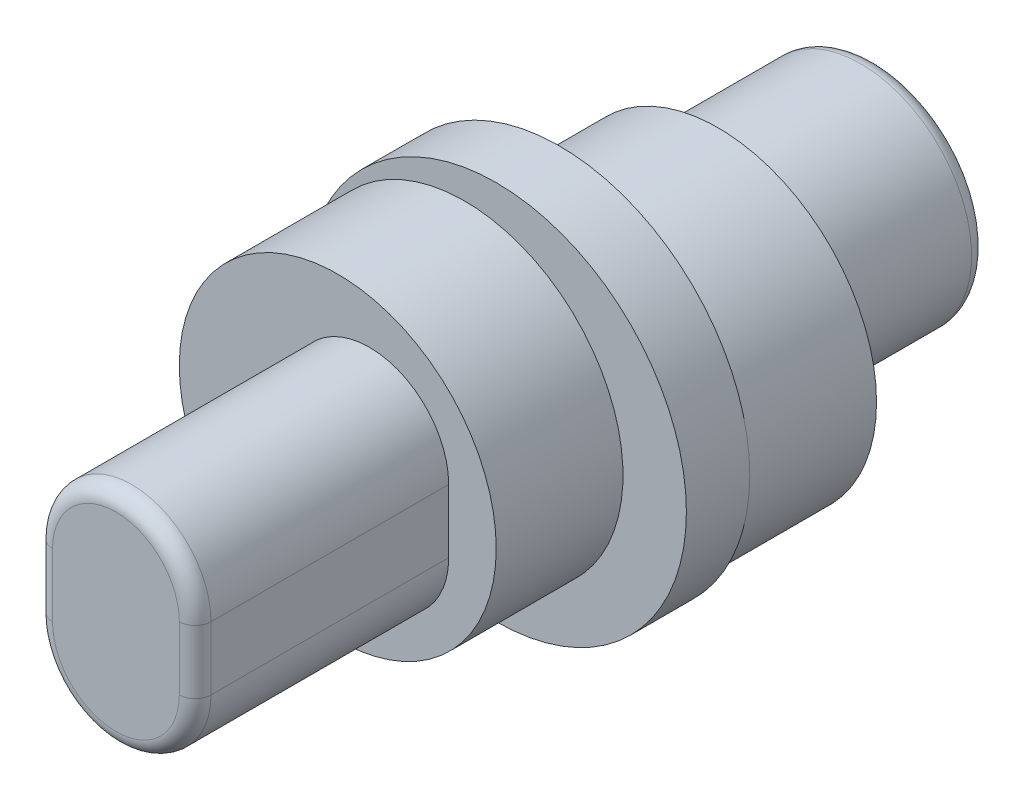
from build123d import *

# Parameters (mm, degrees)
SKETCH_1_R          = 5
EXTRUDE_1_DEPTH     = 4
SKETCH_2_R          = 6
EXTRUDE_2_DEPTH     = 2
SKETCH_3_R          = 5
EXTRUDE_3_DEPTH     = 4
SKETCH_4_R          = 3.5
EXTRUDE_4_DEPTH     = 8
EXTRUDE_START       = 6
SKETCH_5_R          = 3.5
EXTRUDE_5_DEPTH     = 6
CUT_EXTRUDE_START   = -8
CUT_EXTRUDE_2_DEPTH = 8
FILLET_1_R          = 0.5


with BuildPart() as part:
    # 草图1 → 凸台-拉伸1 (new body)
    with BuildSketch(Plane.XY):
        with Locations((-1, 0)):
            Circle(SKETCH_1_R)
    extrude(amount=EXTRUDE_1_DEPTH)

    # 草图2 → 凸台-拉伸2 (add)
    with BuildSketch(Plane(origin=(0, 0, 0), x_dir=(-1, 0, 0), z_dir=(0, 0, -1))):
        Circle(SKETCH_2_R)
    extrude(amount=EXTRUDE_2_DEPTH)

    # 草图3 → 凸台-拉伸3 (add)
    with BuildSketch(Plane(origin=(0, 0, -2), x_dir=(-1, 0, 0), z_dir=(0, 0, -1))):
        with Locations(Location((-1, 0, 0), (0, 0, 179.999112378))):
            Circle(SKETCH_3_R)
    extrude(amount=EXTRUDE_3_DEPTH)

    # 草图4 → 凸台-拉伸4 (add)
    with BuildSketch(Plane.XY.offset(4)):
        Circle(SKETCH_4_R)
    extrude(amount=EXTRUDE_4_DEPTH)

    # 草图5 → 凸台-拉伸5 (add)
    with BuildSketch(Plane(origin=(0, 0, -6), x_dir=(-1, 0, 0), z_dir=(0, 0, -1)).offset(EXTRUDE_START)):
        with Locations(Location((0, 0, 0), (0, 0, 180))):
            Circle(SKETCH_5_R)
    extrude(amount=-EXTRUDE_5_DEPTH)

    # 草图7 → 切除-拉伸2 (cut)
    with BuildSketch(Plane.XY.offset(12).offset(CUT_EXTRUDE_START)):
        with BuildLine():
            ThreePointArc((2.5, -1), (1.767766953, -2.767766953), (0, -3.5))
            ThreePointArc((0, -3.5), (2.474873734, -2.474873734), (3.5, 0))
            ThreePointArc((3.5, 0), (2.47487374, 2.474873729), (1.6e-08, 3.5))
            ThreePointArc((1.6e-08, 3.5), (1.767766959, 2.767766947), (2.5, 1))
            Line((2.5, 1), (2.5, -1))
        make_face()
        with BuildLine():
            ThreePointArc((0, -3.5), (-1.767766953, -2.767766953), (-2.5, -1))
            Line((-2.5, -1), (-2.5, 1))
            ThreePointArc((-2.5, 1), (-1.767766947, 2.767766959), (1.6e-08, 3.5))
            ThreePointArc((1.6e-08, 3.5), (-3.5, 8e-09), (0, -3.5))
        make_face()
    extrude(amount=CUT_EXTRUDE_2_DEPTH, mode=Mode.SUBTRACT)

    # 圆角1
    fillet_1_edges = [part.edges().sort_by_distance(p)[0] for p in [
        (-3.5, 0, -12),
        (0, 3.5, 12),
        (0, -3.5, 12),
        (2.5, 0, 12),
        (-2.5, 0, 12),
    ]]
    fillet(fillet_1_edges, radius=FILLET_1_R)


solid = part.part
